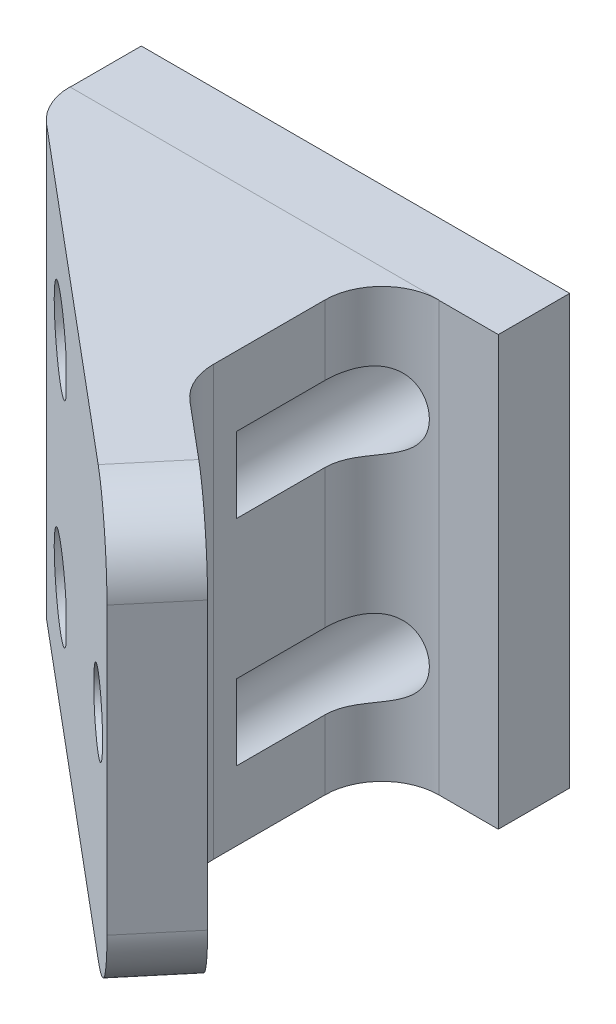
from build123d import *
from build123d.topology import SkipClean

# Parameters (mm, degrees)
SKETCH1_W                = 19.05
SKETCH1_H                = 19.05
SKETCH1_R                = 1.7272
BOSS_EXTRUDE1_DEPTH      = 3.175
BOSS_EXTRUDE3_DEPTH      = 9.5377
BOSS_EXTRUDE3_DEPTH_BACK = 9.525
FILLET3_R                = 3.175
CUT_EXTRUDE1_REACH       = 24.243
SKETCH5_R                = 1.5875
SKETCH6_R                = 1.7272
CUT_EXTRUDE2_DEPTH       = 6.477


with BuildPart() as part:
    # Sketch1 → Boss-Extrude1 (new body)
    with BuildSketch(Plane.XY):
        Rectangle(SKETCH1_W, SKETCH1_H)
        with Locations((-4.7625, 4.7625)):
            Circle(SKETCH1_R, mode=Mode.SUBTRACT)
        with Locations((4.7625, 4.7625)):
            Circle(SKETCH1_R, mode=Mode.SUBTRACT)
        with Locations((4.7625, -4.7625)):
            Circle(SKETCH1_R, mode=Mode.SUBTRACT)
        with Locations((-4.7625, -4.7625)):
            Circle(SKETCH1_R, mode=Mode.SUBTRACT)
    extrude(amount=BOSS_EXTRUDE1_DEPTH)

    # Sketch4 → Boss-Extrude3 (add, two sides: drawn at the far end of the back side and taken through both)
    with BuildSketch(Plane(origin=(0, 0, 0), x_dir=(1, 0, 0), z_dir=(0, 1, 0)).offset(-BOSS_EXTRUDE3_DEPTH_BACK)):
        with BuildLine():
            Line((4.349358433, -10.6723009), (4.349358433, -5.715))
            ThreePointArc((4.349358433, -5.715), (5.093307209, -3.918948776), (6.889358433, -3.175))
            Line((6.889358433, -3.175), (-9.525, -3.175))
            ThreePointArc((-9.525, -3.175), (-9.287021779, -4.248450385), (-8.617680529, -5.120752886))
            Line((-8.617680529, -5.120752886), (8.080209457, -19.131946214))
            Line((8.080209457, -19.131946214), (10.121060118, -16.699755107))
            Line((10.121060118, -16.699755107), (5.256677904, -12.618053786))
            ThreePointArc((5.256677904, -12.618053786), (4.587336654, -11.745751285), (4.349358433, -10.6723009))
        make_face()
    extrude(amount=BOSS_EXTRUDE3_DEPTH + BOSS_EXTRUDE3_DEPTH_BACK)

    # Fillet3
    fillet3_edges = [part.edges().sort_by_distance(p)[0] for p in [
        (9.100634788, -9.525, 17.915850661),
        (9.100634788, 9.5377, 17.915850661),
    ]]
    fillet(fillet3_edges, radius=FILLET3_R)

    # Sketch5 → Cut-Extrude1 (cut, up to next)
    with BuildSketch(Plane(origin=(-6.082096576, 0, 7.248360445), x_dir=(0.7660444431189818, 0, 0.6427876096865349), z_dir=(-0.6427876096865349, 0, 0.7660444431189818)), mode=Mode.PRIVATE) as cut_extrude1_sk1:
        with Locations((15.31257753, 0)):
            Circle(SKETCH5_R)
    cut_extrude1_tool1 = extrude(cut_extrude1_sk1.sketch, amount=-CUT_EXTRUDE1_REACH, mode=Mode.PRIVATE) & part.part
    add(cut_extrude1_tool1.solids().sort_by_distance((5.648018, 0, 17.091096))[0], mode=Mode.SUBTRACT)

    # Sketch6 → Cut-Extrude2 (cut)
    with SkipClean():  # the faces are left unmerged after this step: merging them gives an invalid solid
        with BuildSketch(Plane(origin=(0, 0, 3.175), x_dir=(-1, 0, 0), z_dir=(0, 0, -1))):
            with Locations(Location((4.7625, -4.7625, 0), (0, 0, 153.441985656))):
                Circle(SKETCH6_R)
            with Locations(Location((4.7625, 4.7625, 0), (0, 0, 206.558014344))):
                Circle(SKETCH6_R)
            with Locations(Location((-4.7625, -4.7625, 0), (0, 0, 76.160831111))):
                Circle(SKETCH6_R)
            with Locations(Location((-4.7625, 4.7625, 0), (0, 0, 76.160831111))):
                Circle(SKETCH6_R)
        extrude(amount=-CUT_EXTRUDE2_DEPTH, mode=Mode.SUBTRACT)


solid = part.part
